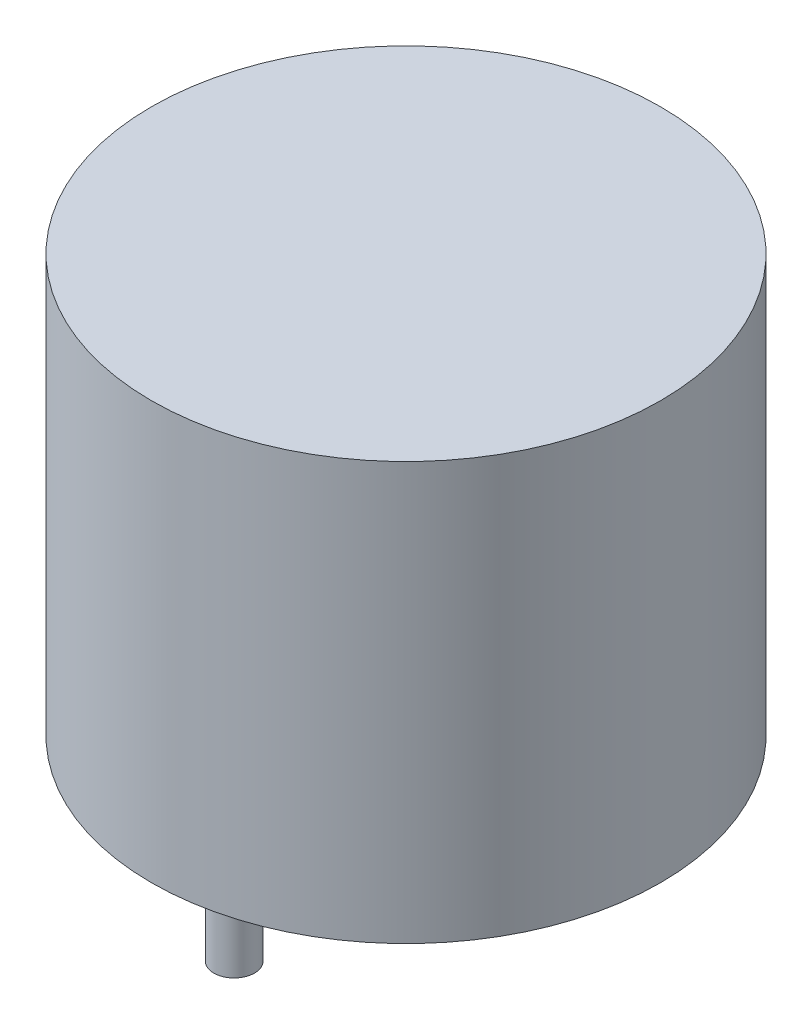
from build123d import *

# Parameters (mm, degrees)
SKETCH_1_R      = 10
EXTRUDE_1_DEPTH = 16.4
SKETCH_2_R      = 0.8
EXTRUDE_2_DEPTH = 4.3


with BuildPart() as part:
    # Эскиз1 → Бобышка-Вытянуть1 (new body)
    with BuildSketch(Plane(origin=(0, 0, 0), x_dir=(1, 0, 0), z_dir=(0, 1, 0))):
        with Locations(Location((0, 0, 0), (0, 0, 270))):
            Circle(SKETCH_1_R)
    extrude(amount=EXTRUDE_1_DEPTH)

    # Эскиз2 → Бобышка-Вытянуть2 (add)
    with BuildSketch(Plane.XZ):
        with Locations(Location((0, 6.75, 0), (0, 0, 90))):
            Circle(SKETCH_2_R)
        with Locations(Location((-6.75, 0, 0), (0, 0, 90))):
            Circle(SKETCH_2_R)
    extrude(amount=EXTRUDE_2_DEPTH)


solid = part.part
